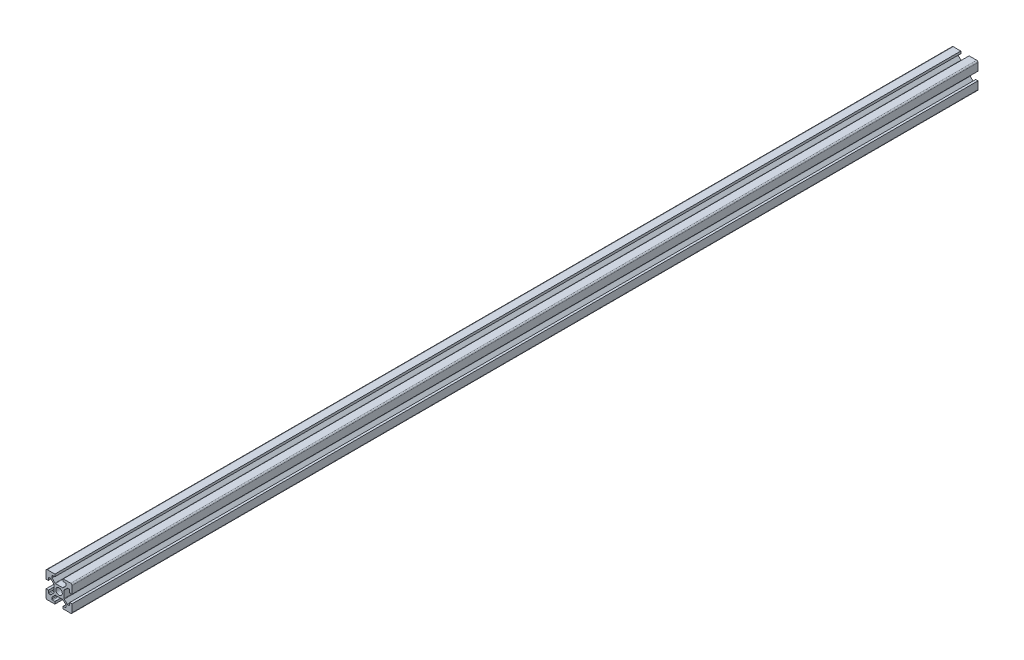
from build123d import *

# Parameters (mm, degrees)
SKETCH1_R           = 2.5
BOSS_EXTRUDE1_DEPTH = 695.1
FILLET1_R           = 1
FILLET2_R           = 0.5
FILLET3_R           = 0.5
FILLET4_R           = 0.5
FILLET5_R           = 0.5


with BuildPart() as part:
    # Sketch1 → Boss-Extrude1 (new body)
    with BuildSketch(Plane.XY):
        Polygon((13.2, 0), (13.2, 1.8), (15.45, 1.8), (15.45, 3.6), (12.95, 6.1), (7.05, 6.1), (4.55, 3.6), (4.55, 1.8), (6.8, 1.8), (6.8, 0), (0, 0), (0, 6.8), (1.8, 6.8), (1.8, 4.55), (3.6, 4.55), (6.1, 7.05), (6.1, 12.95), (3.6, 15.45), (1.8, 15.45), (1.8, 13.2), (0, 13.2), (0, 20), (6.8, 20), (6.8, 18.2), (4.55, 18.2), (4.55, 16.4), (7.05, 13.9), (12.95, 13.9), (15.45, 16.4), (15.45, 18.2), (13.2, 18.2), (13.2, 20), (20, 20), (20, 13.2), (18.2, 13.2), (18.2, 15.45), (16.4, 15.45), (13.9, 12.95), (13.9, 7.05), (16.4, 4.55), (18.2, 4.55), (18.2, 6.8), (20, 6.8), (20, 0), align=None)
        with Locations((10, 10)):
            Circle(SKETCH1_R, mode=Mode.SUBTRACT)
    extrude(amount=BOSS_EXTRUDE1_DEPTH)

    # Fillet1
    fillet1_edges = [part.edges().sort_by_distance(p)[0] for p in [
        (0, 0, 347.55),
        (0, 20, 347.55),
        (20, 20, 347.55),
        (20, 0, 347.55),
    ]]
    fillet(fillet1_edges, radius=FILLET1_R)

    # Fillet2
    fillet2_edges = [part.edges().sort_by_distance(p)[0] for p in [
        (4.55, 18.2, 347.55),
        (4.55, 16.4, 347.55),
        (7.05, 13.9, 347.55),
        (12.95, 13.9, 347.55),
        (15.45, 16.4, 347.55),
        (15.45, 18.2, 347.55),
    ]]
    fillet(fillet2_edges, radius=FILLET2_R)

    # Fillet3
    fillet3_edges = [part.edges().sort_by_distance(p)[0] for p in [
        (18.2, 15.45, 347.55),
        (16.4, 15.45, 347.55),
        (13.9, 12.95, 347.55),
        (13.9, 7.05, 347.55),
        (16.4, 4.55, 347.55),
        (18.2, 4.55, 347.55),
    ]]
    fillet(fillet3_edges, radius=FILLET3_R)

    # Fillet4
    fillet4_edges = [part.edges().sort_by_distance(p)[0] for p in [
        (1.8, 4.55, 347.55),
        (3.6, 4.55, 347.55),
        (6.1, 7.05, 347.55),
        (6.1, 12.95, 347.55),
        (3.6, 15.45, 347.55),
        (1.8, 15.45, 347.55),
    ]]
    fillet(fillet4_edges, radius=FILLET4_R)

    # Fillet5
    fillet5_edges = [part.edges().sort_by_distance(p)[0] for p in [
        (15.45, 1.8, 347.55),
        (15.45, 3.6, 347.55),
        (12.95, 6.1, 347.55),
        (7.05, 6.1, 347.55),
        (4.55, 3.6, 347.55),
        (4.55, 1.8, 347.55),
    ]]
    fillet(fillet5_edges, radius=FILLET5_R)


solid = part.part
